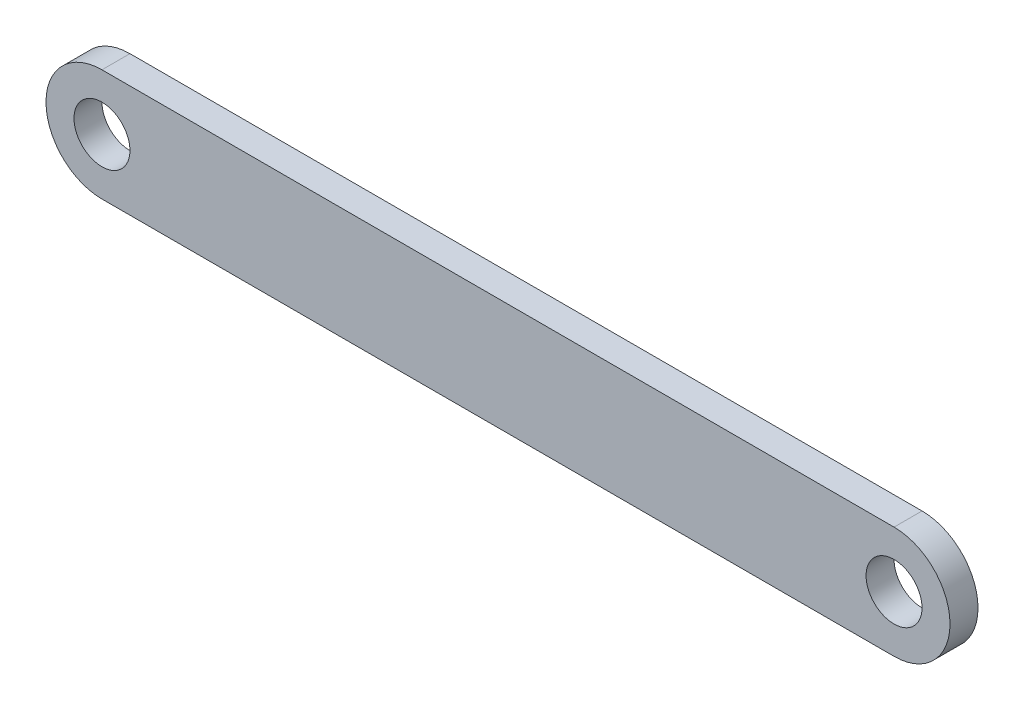
from build123d import *

# Parameters (mm, degrees)
SKETCH1_R      = 1
EXTRUDE1_DEPTH = 1


with BuildPart() as part:
    # Sketch1 → Extrude1 (new body)
    with BuildSketch(Plane.XY):
        with BuildLine():
            Line((0, 2), (-28.3062, 2))
            ThreePointArc((-28.3062, 2), (-30.3062, 0), (-28.3062, -2))
            Line((-28.3062, -2), (0, -2))
            ThreePointArc((0, -2), (2, 0), (0, 2))
        make_face()
        with Locations((-28.3062, 0)):
            Circle(SKETCH1_R, mode=Mode.SUBTRACT)
        Circle(SKETCH1_R, mode=Mode.SUBTRACT)
    extrude(amount=EXTRUDE1_DEPTH)


solid = part.part
